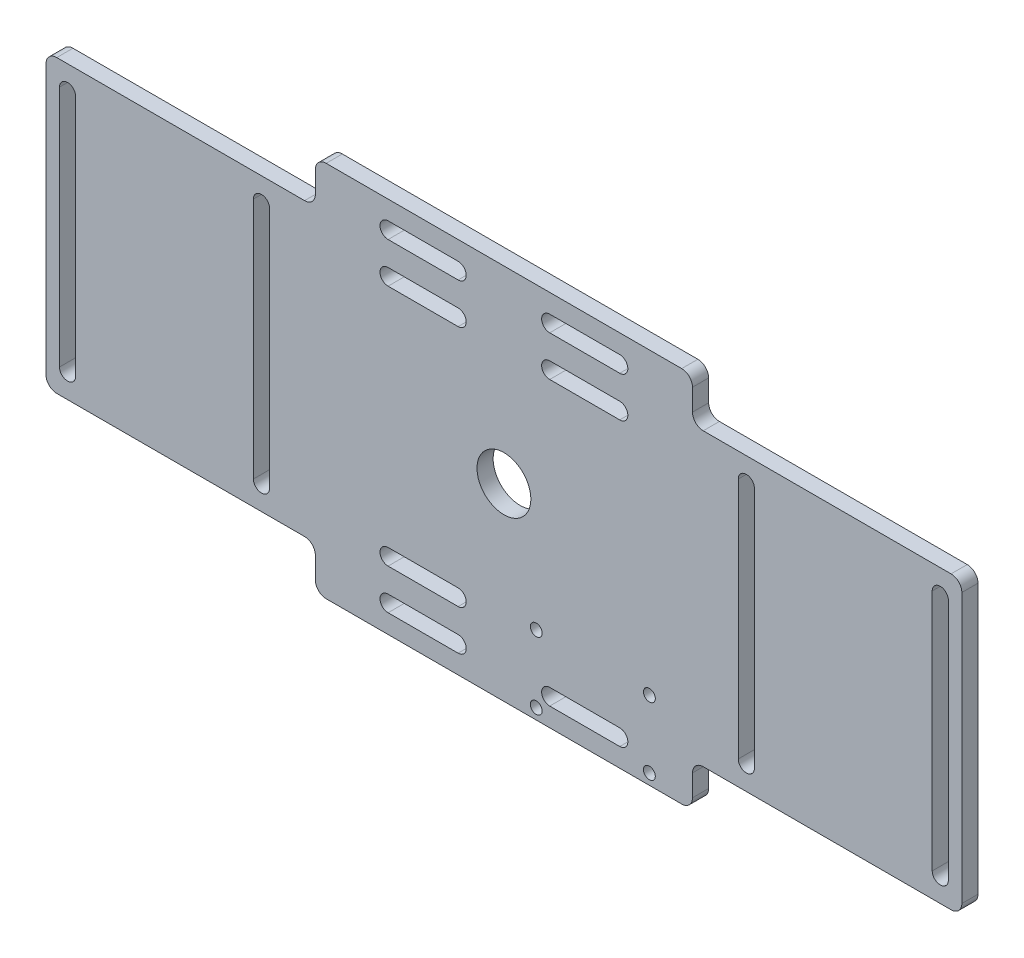
from build123d import *

# Parameters (mm, degrees)
SKETCH_1_W          = 170
SKETCH_1_H          = 70
EXTRUDE_1_DEPTH     = 3
SKETCH_2_R          = 5
SKETCH_2_R_2        = 1.1
CUT_EXTRUDE_1_DEPTH = 92.972822073
CUT_EXTRUDE_2_DEPTH = 92.972822073


with BuildPart() as part:
    # 草圖1 → 填料-伸長1 (new body)
    with BuildSketch(Plane.XY):
        Rectangle(SKETCH_1_W, SKETCH_1_H)
    extrude(amount=EXTRUDE_1_DEPTH)

    # 草圖2 → 除料-伸長1 (cut, through all)
    with BuildSketch(Plane.XY.offset(3)):
        Circle(SKETCH_2_R)
        with Locations((27, -20.5)):
            Circle(SKETCH_2_R_2)
        with Locations((6, -20.5)):
            Circle(SKETCH_2_R_2)
        with Locations((6, -33)):
            Circle(SKETCH_2_R_2)
        with Locations((27, -33)):
            Circle(SKETCH_2_R_2)
        with BuildLine():
            Line((43.5, -22.5), (43.5, 22.5))
            ThreePointArc((43.5, 22.5), (45, 24), (46.5, 22.5))
            Line((46.5, 22.5), (46.5, -22.5))
            ThreePointArc((46.5, -22.5), (45, -24), (43.5, -22.5))
        make_face()
        with BuildLine():
            Line((-46.5, -22.5), (-46.5, 22.5))
            ThreePointArc((-46.5, 22.5), (-45, 24), (-43.5, 22.5))
            Line((-43.5, 22.5), (-43.5, -22.5))
            ThreePointArc((-43.5, -22.5), (-45, -24), (-46.5, -22.5))
        make_face()
        with BuildLine():
            Line((-82.5, -22.5), (-82.5, 22.5))
            ThreePointArc((-82.5, 22.5), (-81, 24), (-79.5, 22.5))
            Line((-79.5, 22.5), (-79.5, -22.5))
            ThreePointArc((-79.5, -22.5), (-81, -24), (-82.5, -22.5))
        make_face()
        with BuildLine():
            Line((79.5, -22.5), (79.5, 22.5))
            ThreePointArc((79.5, 22.5), (81, 24), (82.5, 22.5))
            Line((82.5, 22.5), (82.5, -22.5))
            ThreePointArc((82.5, -22.5), (81, -24), (79.5, -22.5))
        make_face()
        with BuildLine():
            Line((21.5, -31.5), (8.5, -31.5))
            ThreePointArc((8.5, -31.5), (7, -30), (8.5, -28.5))
            Line((8.5, -28.5), (21.5, -28.5))
            ThreePointArc((21.5, -28.5), (23, -30), (21.5, -31.5))
        make_face()
        with BuildLine():
            Line((-21.5, -31.5), (-8.5, -31.5))
            ThreePointArc((-8.5, -31.5), (-7, -30), (-8.5, -28.5))
            Line((-8.5, -28.5), (-21.5, -28.5))
            ThreePointArc((-21.5, -28.5), (-23, -30), (-21.5, -31.5))
        make_face()
        with BuildLine():
            Line((21.5, 31.5), (8.5, 31.5))
            ThreePointArc((8.5, 31.5), (7, 30), (8.5, 28.5))
            Line((8.5, 28.5), (21.5, 28.5))
            ThreePointArc((21.5, 28.5), (23, 30), (21.5, 31.5))
        make_face()
        with BuildLine():
            Line((-21.5, 31.5), (-8.5, 31.5))
            ThreePointArc((-8.5, 31.5), (-7, 30), (-8.5, 28.5))
            Line((-8.5, 28.5), (-21.5, 28.5))
            ThreePointArc((-21.5, 28.5), (-23, 30), (-21.5, 31.5))
        make_face()
        with BuildLine():
            Line((21.5, 24), (8.5, 24))
            ThreePointArc((8.5, 24), (7, 22.5), (8.5, 21))
            Line((8.5, 21), (21.5, 21))
            ThreePointArc((21.5, 21), (23, 22.5), (21.5, 24))
        make_face()
        with BuildLine():
            Line((-21.5, 24), (-8.5, 24))
            ThreePointArc((-8.5, 24), (-7, 22.5), (-8.5, 21))
            Line((-8.5, 21), (-21.5, 21))
            ThreePointArc((-21.5, 21), (-23, 22.5), (-21.5, 24))
        make_face()
        with BuildLine():
            Line((-21.5, -24), (-8.5, -24))
            ThreePointArc((-8.5, -24), (-7, -22.5), (-8.5, -21))
            Line((-8.5, -21), (-21.5, -21))
            ThreePointArc((-21.5, -21), (-23, -22.5), (-21.5, -24))
        make_face()
    extrude(amount=-CUT_EXTRUDE_1_DEPTH, mode=Mode.SUBTRACT)

    # 草圖4 → 除料-伸長2 (cut, through all)
    with BuildSketch(Plane.XY.offset(3)):
        with BuildLine():
            Line((85, 35), (35, 35))
            Line((35, 35), (33, 35))
            ThreePointArc((33, 35), (34.414213562, 34.414213562), (35, 33))
            Line((35, 33), (35, 29))
            ThreePointArc((35, 29), (35.585786438, 27.585786438), (37, 27))
            Line((37, 27), (83, 27))
            ThreePointArc((83, 27), (84.414213562, 26.414213562), (85, 25))
            Line((85, 25), (85, 27))
            Line((85, 27), (85, 35))
        make_face()
        with BuildLine():
            Line((85, -27), (85, -25))
            ThreePointArc((85, -25), (84.414213562, -26.414213562), (83, -27))
            Line((83, -27), (37, -27))
            ThreePointArc((37, -27), (35.585786438, -27.585786438), (35, -29))
            Line((35, -29), (35, -33))
            ThreePointArc((35, -33), (34.414213562, -34.414213562), (33, -35))
            Line((33, -35), (35, -35))
            Line((35, -35), (85, -35))
            Line((85, -35), (85, -27))
        make_face()
        with BuildLine():
            Line((-85, -35), (-35, -35))
            Line((-35, -35), (-33, -35))
            ThreePointArc((-33, -35), (-34.414213562, -34.414213562), (-35, -33))
            Line((-35, -33), (-35, -29))
            ThreePointArc((-35, -29), (-35.585786438, -27.585786438), (-37, -27))
            Line((-37, -27), (-83, -27))
            ThreePointArc((-83, -27), (-84.414213562, -26.414213562), (-85, -25))
            Line((-85, -25), (-85, -27))
            Line((-85, -27), (-85, -35))
        make_face()
        with BuildLine():
            Line((-85, 27), (-85, 25))
            ThreePointArc((-85, 25), (-84.414213562, 26.414213562), (-83, 27))
            Line((-83, 27), (-37, 27))
            ThreePointArc((-37, 27), (-35.585786438, 27.585786438), (-35, 29))
            Line((-35, 29), (-35, 33))
            ThreePointArc((-35, 33), (-34.414213562, 34.414213562), (-33, 35))
            Line((-33, 35), (-35, 35))
            Line((-35, 35), (-85, 35))
            Line((-85, 35), (-85, 27))
        make_face()
    extrude(amount=-CUT_EXTRUDE_2_DEPTH, mode=Mode.SUBTRACT)


solid = part.part
